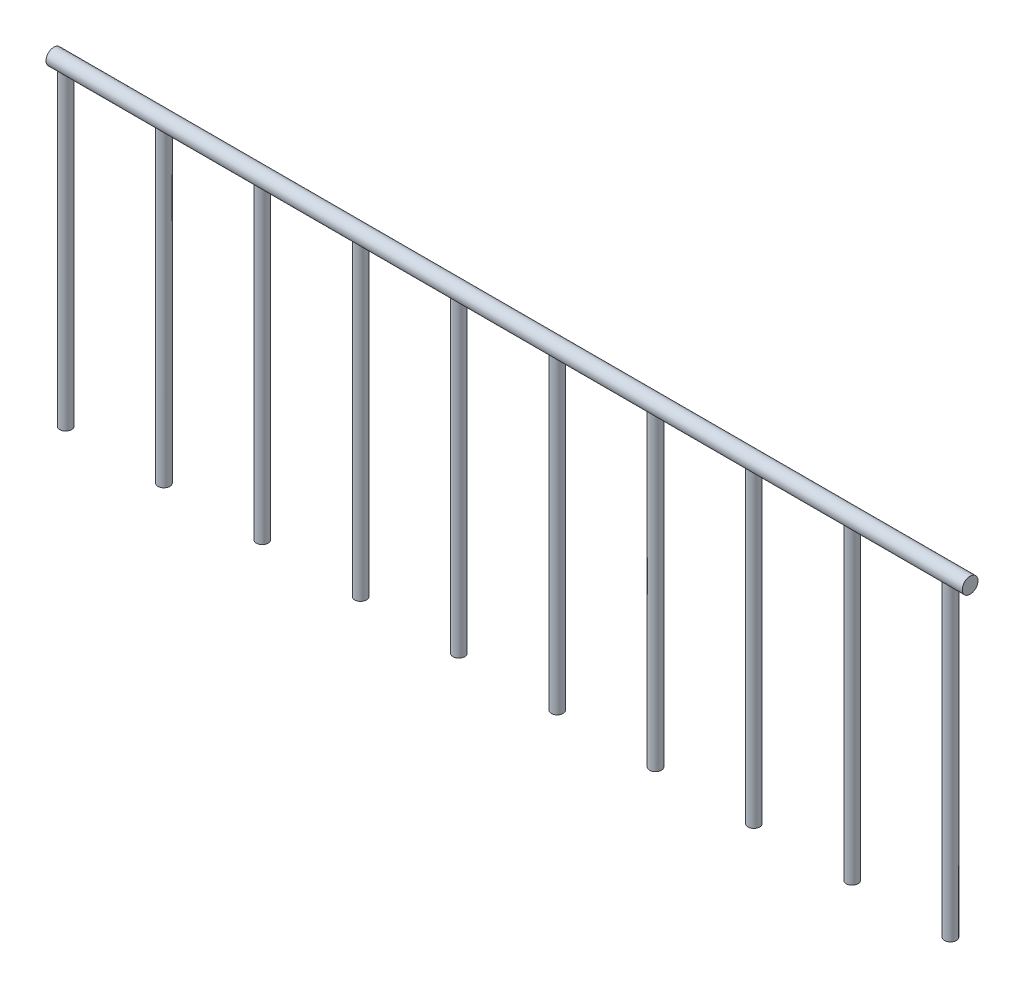
from build123d import *

# Parameters (mm, degrees)
SKETCH1_R                 = 1.5
VERTICAL_BARS_DEPTH       = 40
VERTICAL_BARS_2_DEPTH     = 40
VERTICAL_BARS_3_DEPTH     = 40
VERTICAL_BARS_4_DEPTH     = 40
VERTICAL_BARS_5_DEPTH     = 40
VERTICAL_BARS_6_DEPTH     = 40
VERTICAL_BARS_7_DEPTH     = 40
VERTICAL_BARS_8_DEPTH     = 40
VERTICAL_BARS_9_DEPTH     = 40
VERTICAL_BARS_10_DEPTH    = 40
HORIZONTAL_BAR_DEPTH      = 230
HORIZONTAL_BAR_DEPTH_BACK = 3
SKETCH2_R                 = 2


with BuildPart() as part:
    # Sketch1 → Vertical Bars (new, symmetric)
    with BuildSketch(Plane(origin=(0, 0, 0), x_dir=(1, 0, 0), z_dir=(0, 1, 0))):
        with Locations(Location((0, 0, 0), (0, 0, 270))):
            Circle(SKETCH1_R)
    extrude(amount=VERTICAL_BARS_DEPTH, both=True)



with BuildPart() as body_2:
    # Sketch1 → Vertical Bars 2 (new, symmetric)
    with BuildSketch(Plane(origin=(0, 0, 0), x_dir=(1, 0, 0), z_dir=(0, 1, 0))):
        with Locations(Location((25, 0, 0), (0, 0, 270))):
            Circle(SKETCH1_R)
    extrude(amount=VERTICAL_BARS_2_DEPTH, both=True)


with BuildPart() as body_3:
    # Sketch1 → Vertical Bars 3 (new, symmetric)
    with BuildSketch(Plane(origin=(0, 0, 0), x_dir=(1, 0, 0), z_dir=(0, 1, 0))):
        with Locations(Location((50, 0, 0), (0, 0, 270))):
            Circle(SKETCH1_R)
    extrude(amount=VERTICAL_BARS_3_DEPTH, both=True)


with BuildPart() as body_4:
    # Sketch1 → Vertical Bars 4 (new, symmetric)
    with BuildSketch(Plane(origin=(0, 0, 0), x_dir=(1, 0, 0), z_dir=(0, 1, 0))):
        with Locations(Location((75, 0, 0), (0, 0, 270))):
            Circle(SKETCH1_R)
    extrude(amount=VERTICAL_BARS_4_DEPTH, both=True)


with BuildPart() as body_5:
    # Sketch1 → Vertical Bars 5 (new, symmetric)
    with BuildSketch(Plane(origin=(0, 0, 0), x_dir=(1, 0, 0), z_dir=(0, 1, 0))):
        with Locations(Location((100, 0, 0), (0, 0, 270))):
            Circle(SKETCH1_R)
    extrude(amount=VERTICAL_BARS_5_DEPTH, both=True)


with BuildPart() as body_6:
    # Sketch1 → Vertical Bars 6 (new, symmetric)
    with BuildSketch(Plane(origin=(0, 0, 0), x_dir=(1, 0, 0), z_dir=(0, 1, 0))):
        with Locations(Location((125, 0, 0), (0, 0, 270))):
            Circle(SKETCH1_R)
    extrude(amount=VERTICAL_BARS_6_DEPTH, both=True)


with BuildPart() as body_7:
    # Sketch1 → Vertical Bars 7 (new, symmetric)
    with BuildSketch(Plane(origin=(0, 0, 0), x_dir=(1, 0, 0), z_dir=(0, 1, 0))):
        with Locations(Location((150, 0, 0), (0, 0, 270))):
            Circle(SKETCH1_R)
    extrude(amount=VERTICAL_BARS_7_DEPTH, both=True)


with BuildPart() as body_8:
    # Sketch1 → Vertical Bars 8 (new, symmetric)
    with BuildSketch(Plane(origin=(0, 0, 0), x_dir=(1, 0, 0), z_dir=(0, 1, 0))):
        with Locations(Location((175, 0, 0), (0, 0, 270))):
            Circle(SKETCH1_R)
    extrude(amount=VERTICAL_BARS_8_DEPTH, both=True)


with BuildPart() as body_9:
    # Sketch1 → Vertical Bars 9 (new, symmetric)
    with BuildSketch(Plane(origin=(0, 0, 0), x_dir=(1, 0, 0), z_dir=(0, 1, 0))):
        with Locations(Location((200, 0, 0), (0, 0, 270))):
            Circle(SKETCH1_R)
    extrude(amount=VERTICAL_BARS_9_DEPTH, both=True)


with BuildPart() as body_10:
    # Sketch1 → Vertical Bars 10 (new, symmetric)
    with BuildSketch(Plane(origin=(0, 0, 0), x_dir=(1, 0, 0), z_dir=(0, 1, 0))):
        with Locations(Location((225, 0, 0), (0, 0, 270))):
            Circle(SKETCH1_R)
    extrude(amount=VERTICAL_BARS_10_DEPTH, both=True)


with BuildPart() as part_1:
    add(part.part)

    add(body_2.part)  # Horizontal Bar merges body 2

    add(body_3.part)  # Horizontal Bar merges body 3

    add(body_4.part)  # Horizontal Bar merges body 4

    add(body_5.part)  # Horizontal Bar merges body 5
    # Sketch2 → Horizontal Bar (add, two sides: drawn at the far end of the back side and taken through both)
    with BuildSketch(Plane(origin=(0, 0, 0), x_dir=(0, 0, -1), z_dir=(1, 0, 0)).offset(-HORIZONTAL_BAR_DEPTH_BACK)):
        with Locations((0, 40)):
            Circle(SKETCH2_R)
    extrude(amount=HORIZONTAL_BAR_DEPTH + HORIZONTAL_BAR_DEPTH_BACK)


solid = Compound([body_6.part, body_7.part, body_8.part, body_9.part, body_10.part, part_1.part])
